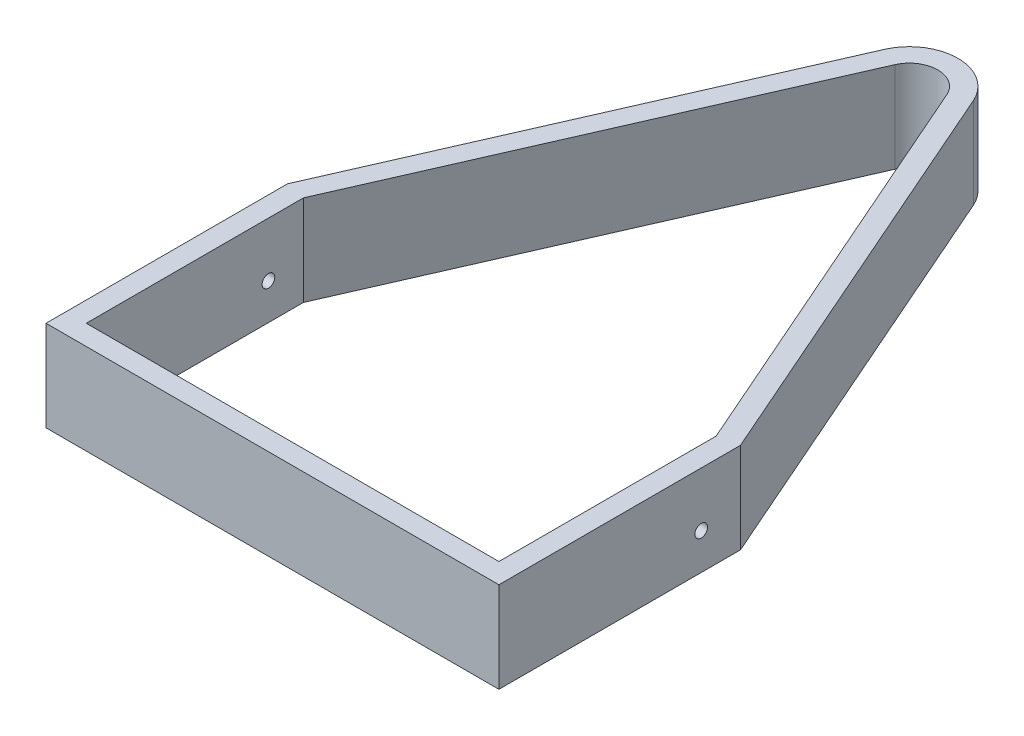
from build123d import *

# Parameters (mm, degrees)
BOSS_EXTRUDE1_DEPTH = 28.575
CUT_EXTRUDE1_REACH  = 296.594
CUT_EXTRUDE1_START  = -65.0875
SKETCH2_R           = 2
CUT_EXTRUDE3_REACH  = 296.594
CUT_EXTRUDE3_START  = 65.0875
SKETCH2_2_R         = 2


with BuildPart() as part:
    # Sketch1 → Boss-Extrude1 (new body)
    with BuildSketch(Plane(origin=(0, 0, 0), x_dir=(1, 0, 0), z_dir=(0, 1, 0))):
        with BuildLine():
            Line((-71.4375, 0), (71.4375, 0))
            Line((71.4375, 0), (71.4375, 76.2))
            Line((71.4375, 76.2), (14.018084439, 207.068004883))
            ThreePointArc((14.018084439, 207.068004883), (0, 216.225490533), (-14.018084439, 207.068004883))
            Line((-14.018084439, 207.068004883), (-71.4375, 76.2))
            Line((-71.4375, 76.2), (-71.4375, 0))
        make_face()
        with BuildLine():
            Line((-65.0875, 6.35), (-65.0875, 74.868218206))
            Line((-65.0875, 74.868218206), (-8.203175338, 204.516665597))
            ThreePointArc((-8.203175338, 204.516665597), (0, 209.875490533), (8.203175338, 204.516665597))
            Line((8.203175338, 204.516665597), (65.0875, 74.868218206))
            Line((65.0875, 74.868218206), (65.0875, 6.35))
            Line((65.0875, 6.35), (-65.0875, 6.35))
        make_face(mode=Mode.SUBTRACT)
    extrude(amount=BOSS_EXTRUDE1_DEPTH)

    # Sketch2 → Cut-Extrude1 (cut, up to next)
    with BuildSketch(Plane(origin=(0, 0, 0), x_dir=(0, 0, -1), z_dir=(1, 0, 0)).offset(CUT_EXTRUDE1_START), mode=Mode.PRIVATE) as cut_extrude1_sk1:
        with Locations((63.819218206, 11.43)):
            Circle(SKETCH2_R)
    cut_extrude1_tool1 = extrude(cut_extrude1_sk1.sketch, amount=-CUT_EXTRUDE1_REACH, mode=Mode.PRIVATE) & part.part
    add(cut_extrude1_tool1.solids().sort_by_distance((-65.0875, 11.43, -63.819218))[0], mode=Mode.SUBTRACT)

    # Sketch2<2> → Cut-Extrude3 (cut, up to next)
    with BuildSketch(Plane(origin=(0, 0, 0), x_dir=(0, 0, -1), z_dir=(1, 0, 0)).offset(CUT_EXTRUDE3_START), mode=Mode.PRIVATE) as cut_extrude3_sk1:
        with Locations((63.819218206, 11.43)):
            Circle(SKETCH2_2_R)
    cut_extrude3_tool1 = extrude(cut_extrude3_sk1.sketch, amount=CUT_EXTRUDE3_REACH, mode=Mode.PRIVATE) & part.part
    add(cut_extrude3_tool1.solids().sort_by_distance((65.0875, 11.43, -63.819218))[0], mode=Mode.SUBTRACT)


solid = part.part
